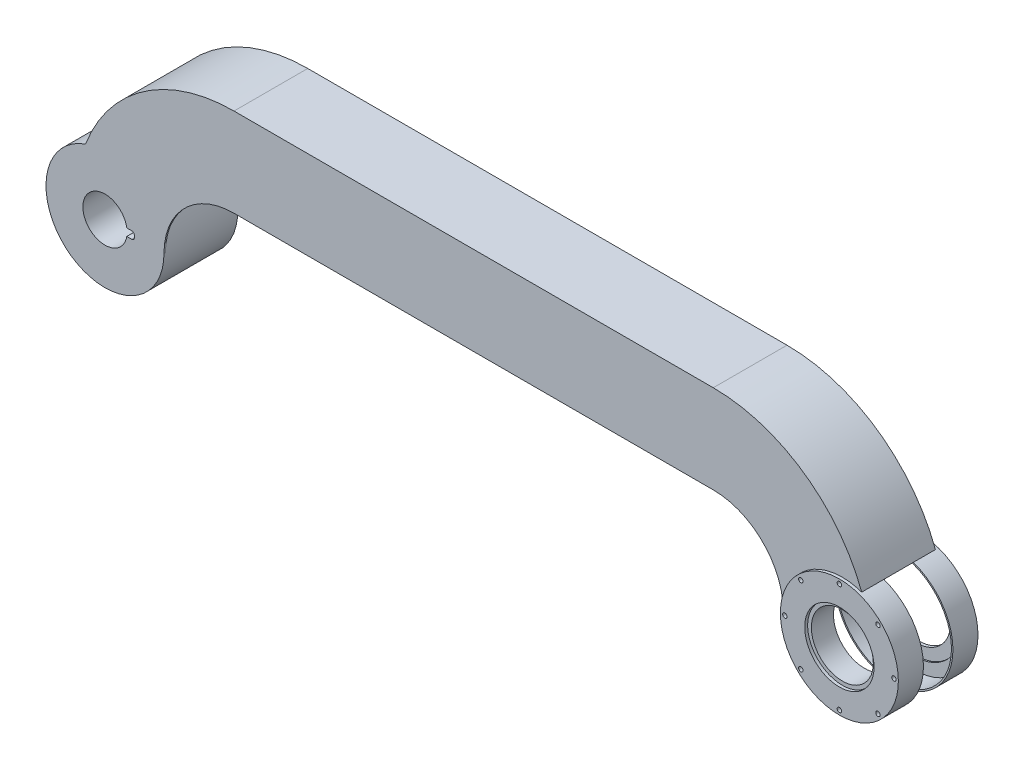
from build123d import *

# Parameters (mm, degrees)
BOSS_EXTRUDE1_DEPTH = 1
BOSS_EXTRUDE2_DEPTH = 25
SKETCH1_11_R        = 40
SKETCH1_11_R_2      = 37.5
SKETCH1_11_R_3      = 21
BOSS_EXTRUDE3_DEPTH = 2
SKETCH1_12_R        = 21
BOSS_EXTRUDE4_DEPTH = 25
SKETCH1_13_R        = 40
SKETCH1_13_R_2      = 37.5
BOSS_EXTRUDE5_DEPTH = 25
BOSS_EXTRUDE6_START = -2
SKETCH1_14_R        = 40
SKETCH1_14_R_2      = 23.5
SKETCH1_14_R_3      = 39
BOSS_EXTRUDE6_DEPTH = 3
SKETCH1_15_R        = 23.5
SKETCH1_15_R_2      = 21
BOSS_EXTRUDE7_DEPTH = 15
SKETCH1_16_R        = 40
SKETCH1_16_R_2      = 39
BOSS_EXTRUDE8_DEPTH = 15
SKETCH1_17_R        = 37.5
SKETCH1_17_R_2      = 21
CUT_EXTRUDE1_DEPTH  = 2
SKETCH3_R           = 31
CUT_EXTRUDE2_DEPTH  = 22
SKETCH4_R           = 1.5
CUT_EXTRUDE3_DEPTH  = 62


with BuildPart() as part:
    # Sketch1 → Boss-Extrude1 (new body)
    with BuildSketch(Plane.XY):
        with BuildLine():
            ThreePointArc((87.5, 105.5), (28.068160961, 87.167118275), (-10.708571429, 38.539933808))
            ThreePointArc((-10.708571429, 38.539933808), (21.483664092, 33.740956969), (39.451428571, 6.601877284))
            ThreePointArc((39.451428571, 6.601877284), (55.624782732, 36.554350277), (87.5, 48.5))
            Line((87.5, 48.5), (412.5, 48.5))
            ThreePointArc((412.5, 48.5), (444.375217268, 36.554350277), (460.548571429, 6.601877284))
            ThreePointArc((460.548571429, 6.601877284), (478.516335908, 33.740956969), (510.708571429, 38.539933808))
            ThreePointArc((510.708571429, 38.539933808), (471.931839039, 87.167118275), (412.5, 105.5))
            Line((412.5, 105.5), (87.5, 105.5))
        make_face()
        with BuildLine():
            ThreePointArc((39.451428571, 6.601877284), (39.862621231, 3.312314685), (40, 0))
            ThreePointArc((40, 0), (53.912427894, 33.587572106), (87.5, 47.5))
            Line((87.5, 47.5), (412.5, 47.5))
            ThreePointArc((412.5, 47.5), (446.087572106, 33.587572106), (460, 0))
            ThreePointArc((460, 0), (460.137378769, 3.312314685), (460.548571429, 6.601877284))
            ThreePointArc((460.548571429, 6.601877284), (444.375217268, 36.554350277), (412.5, 48.5))
            Line((412.5, 48.5), (87.5, 48.5))
            ThreePointArc((87.5, 48.5), (55.624782732, 36.554350277), (39.451428571, 6.601877284))
        make_face()
    boss_extrude1 = extrude(amount=BOSS_EXTRUDE1_DEPTH)

    # Sketch1<10> → Boss-Extrude2 (add)
    with BuildSketch(Plane.XY):
        with BuildLine():
            Line((412.5, 107.5), (87.5, 107.5))
            ThreePointArc((87.5, 107.5), (26.283214045, 88.367160854), (-13.142857143, 37.779164974))
            ThreePointArc((-13.142857143, 37.779164974), (-11.931779144, 38.178955545), (-10.708571429, 38.539933808))
            ThreePointArc((-10.708571429, 38.539933808), (28.068160961, 87.167118275), (87.5, 105.5))
            Line((87.5, 105.5), (412.5, 105.5))
            ThreePointArc((412.5, 105.5), (471.931839039, 87.167118275), (510.708571429, 38.539933808))
            ThreePointArc((510.708571429, 38.539933808), (511.931779144, 38.178955545), (513.142857143, 37.779164974))
            ThreePointArc((513.142857143, 37.779164974), (473.716785955, 88.367160854), (412.5, 107.5))
        make_face()
    boss_extrude2 = extrude(amount=BOSS_EXTRUDE2_DEPTH)

    # Sketch1<11> → Boss-Extrude3 (add)
    # profile 1 of 2: a face of its own
    with BuildSketch(Plane.XY):
        Circle(SKETCH1_11_R)
        Circle(SKETCH1_11_R_2, mode=Mode.SUBTRACT)
    # profile 2 of 2: a face of its own
    with BuildSketch(Plane.XY):
        Circle(SKETCH1_11_R_2)
        Circle(SKETCH1_11_R_3, mode=Mode.SUBTRACT)
    boss_extrude3 = extrude(amount=BOSS_EXTRUDE3_DEPTH)

    # Sketch1<12> → Boss-Extrude4 (add)
    with BuildSketch(Plane.XY):
        Circle(SKETCH1_12_R)
        with BuildLine():
            ThreePointArc((14.790199458, -2.5), (-15, 0), (14.790199458, 2.5))
            Line((14.790199458, 2.5), (18, 2.5))
            ThreePointArc((18, 2.5), (19.414213562, 1.914213562), (20, 0.5))
            Line((20, 0.5), (20, -0.5))
            ThreePointArc((20, -0.5), (19.414213562, -1.914213562), (18, -2.5))
            Line((18, -2.5), (14.790199458, -2.5))
        make_face(mode=Mode.SUBTRACT)
    boss_extrude4 = extrude(amount=BOSS_EXTRUDE4_DEPTH)

    # Sketch1<13> → Boss-Extrude5 (add)
    with BuildSketch(Plane.XY):
        Circle(SKETCH1_13_R)
        Circle(SKETCH1_13_R_2, mode=Mode.SUBTRACT)
    boss_extrude5 = extrude(amount=BOSS_EXTRUDE5_DEPTH)

    # Sketch1<14> → Boss-Extrude6 (add)
    # profile 1 of 2: a face of its own
    with BuildSketch(Plane.XY.offset(BOSS_EXTRUDE6_START)):
        with Locations((500, 0)):
            Circle(SKETCH1_14_R)
        with Locations((500, 0)):
            Circle(SKETCH1_14_R_2, mode=Mode.SUBTRACT)
    # profile 2 of 2: a face of its own
    with BuildSketch(Plane.XY.offset(BOSS_EXTRUDE6_START)):
        with Locations((500, 0)):
            Circle(SKETCH1_14_R_3)
        with Locations((500, 0)):
            Circle(SKETCH1_14_R_2, mode=Mode.SUBTRACT)
    boss_extrude6 = extrude(amount=BOSS_EXTRUDE6_DEPTH)

    # Sketch1<15> → Boss-Extrude7 (add)
    with BuildSketch(Plane.XY):
        with Locations((500, 0)):
            Circle(SKETCH1_15_R)
        with Locations((500, 0)):
            Circle(SKETCH1_15_R_2, mode=Mode.SUBTRACT)
    boss_extrude7 = extrude(amount=BOSS_EXTRUDE7_DEPTH)

    # Sketch1<16> → Boss-Extrude8 (add)
    with BuildSketch(Plane.XY):
        with Locations((500, 0)):
            Circle(SKETCH1_16_R)
        with Locations((500, 0)):
            Circle(SKETCH1_16_R_2, mode=Mode.SUBTRACT)
    boss_extrude8 = extrude(amount=BOSS_EXTRUDE8_DEPTH)

    # Mirror1: Boss-Extrude2, Boss-Extrude3, Boss-Extrude4, Boss-Extrude5, Boss-Extrude6, Boss-Extrude7, Boss-Extrude8 across plane
    add(boss_extrude2.mirror(Plane.XY.offset(25)))
    add(boss_extrude3.mirror(Plane.XY.offset(25)))
    add(boss_extrude4.mirror(Plane.XY.offset(25)))
    add(boss_extrude5.mirror(Plane.XY.offset(25)))
    add(boss_extrude6.mirror(Plane.XY.offset(25)))
    add(boss_extrude7.mirror(Plane.XY.offset(25)))
    add(boss_extrude8.mirror(Plane.XY.offset(25)))

    # Mirror2: Boss-Extrude1 across plane
    add(boss_extrude1.mirror(Plane.XY.offset(25)))

    # Sketch1<17> → Cut-Extrude1 (cut)
    with BuildSketch(Plane.XY):
        with Locations(Location((0, 0, 0), (0, 0, 180))):
            Circle(SKETCH1_17_R)
        with Locations(Location((0, 0, 0), (0, 0, 180))):
            Circle(SKETCH1_17_R_2, mode=Mode.SUBTRACT)
    extrude(amount=CUT_EXTRUDE1_DEPTH, mode=Mode.SUBTRACT)

    # Sketch3 → Cut-Extrude2 (cut)
    with BuildSketch(Plane.XY):
        with Locations((500, 0)):
            Circle(SKETCH3_R)
    extrude(amount=CUT_EXTRUDE2_DEPTH, mode=Mode.SUBTRACT)

    # Sketch4 → Cut-Extrude3 (cut)
    with BuildSketch(Plane(origin=(0, 0, -2), x_dir=(-1, 0, 0), z_dir=(0, 0, -1))):
        with Locations((-500, 37)):
            Circle(SKETCH4_R)
        with Locations((-473.837049096, 26.162950904)):
            Circle(SKETCH4_R)
        with Locations((-463, 0)):
            Circle(SKETCH4_R)
        with Locations((-473.837049096, -26.162950904)):
            Circle(SKETCH4_R)
        with Locations((-500, -37)):
            Circle(SKETCH4_R)
        with Locations((-526.162950904, -26.162950904)):
            Circle(SKETCH4_R)
        with Locations((-537, 0)):
            Circle(SKETCH4_R)
        with Locations((-526.162950904, 26.162950904)):
            Circle(SKETCH4_R)
    extrude(amount=-CUT_EXTRUDE3_DEPTH, mode=Mode.SUBTRACT)


solid = part.part
